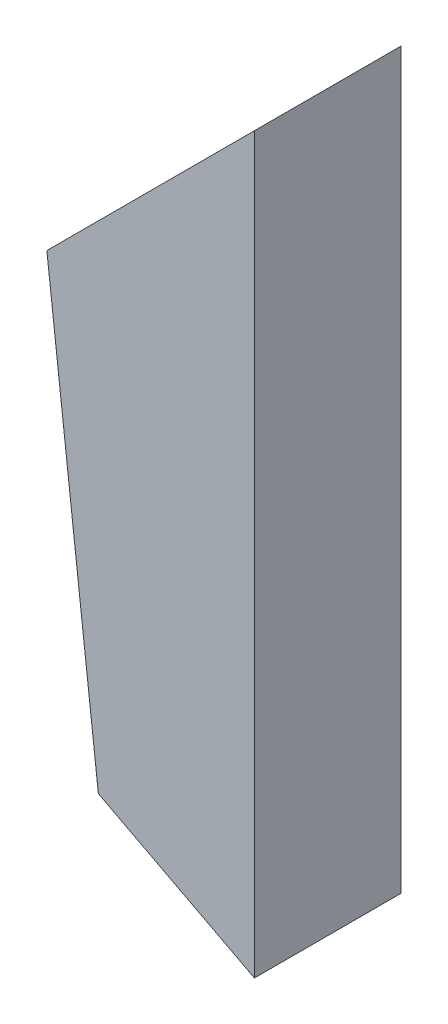
from build123d import *

# Parameters (mm, degrees)
BOSS_EXTRUDE1_DEPTH = 10


with BuildPart() as part:
    # Sketch1 → Boss-Extrude1 (new body)
    with BuildSketch(Plane.XY):
        Polygon((0, 0), (14.142135624, 14.142135624), (14.142135624, -35.857864376), (3.509997907, -30.293904673), align=None)
    extrude(amount=BOSS_EXTRUDE1_DEPTH)


solid = part.part
